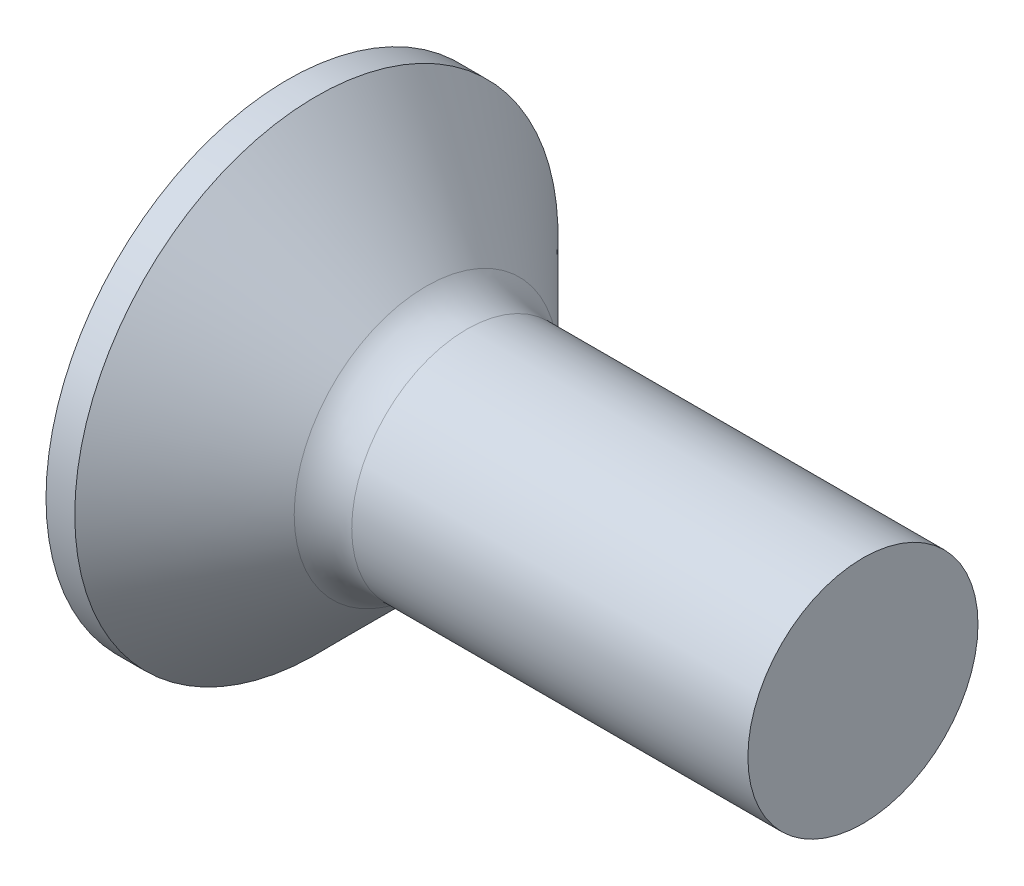
from build123d import *

# Parameters (mm, degrees)
FILLET1_R    = 1
RECPAT_COUNT = 2
RECPAT_ANGLE = 90


with BuildPart() as part:
    # BodySke → Base-Revolve (revolve)
    with BuildSketch(Plane.XY, mode=Mode.PRIVATE) as base_revolve_sk:
        Polygon((0, 0), (0, 4.2), (0.5, 4.2), (2.7, 2), (10, 2), (10, 0), align=None)
    revolve(base_revolve_sk.sketch.rotate(Axis((-6.35, 0, 0), (1, 0, 0)), 90), axis=Axis((-6.35, 0, 0), (1, 0, 0)))

    # Fillet1
    fillet1_edges = [part.edges().sort_by_distance(p)[0] for p in [
        (2.7, 0, -2),
    ]]
    fillet(fillet1_edges, radius=FILLET1_R)

    # Sketch3 → Recess section 0
    with BuildSketch(Plane.ZY):
        with BuildLine():
            Line((-0.515, 2.2), (0.515, 2.2))
            Line((0.515, 2.2), (0.515, -2.2))
            Line((0.515, -2.2), (-0.515, -2.2))
            Line((-0.515, -2.2), (-0.515, 2.2))
        make_face()
    # Sketch4 → Recess section 1
    with BuildSketch(Plane.ZY.offset(-2.51)):
        with BuildLine():
            Line((-0.515, 0.948560373), (0.515, 0.948560373))
            Line((0.515, 0.948560373), (0.515, -0.948560373))
            Line((0.515, -0.948560373), (-0.515, -0.948560373))
            Line((-0.515, -0.948560373), (-0.515, 0.948560373))
        make_face()
    recess = loft(mode=Mode.SUBTRACT)

    # RecPat: Recess ×2 about axis
    recpat_axis = Axis((0, 0, 0), (1, 0, 0))
    for i in range(1, RECPAT_COUNT):
        add(recess.rotate(recpat_axis, i * RECPAT_ANGLE / (RECPAT_COUNT - 1)), mode=Mode.SUBTRACT)

    # RecCorSke → RecessCore (revolve, cut)
    with BuildSketch(Plane.XY, mode=Mode.PRIVATE) as recesscore_sk:
        Polygon((0, 0), (0, 1.026516298), (2.51, 0.851), (2.786506661, 0), align=None)
    revolve(recesscore_sk.sketch.rotate(Axis((-3.175, 0, 0), (1, 0, 0)), 90), axis=Axis((-3.175, 0, 0), (1, 0, 0)), mode=Mode.SUBTRACT)


solid = part.part
